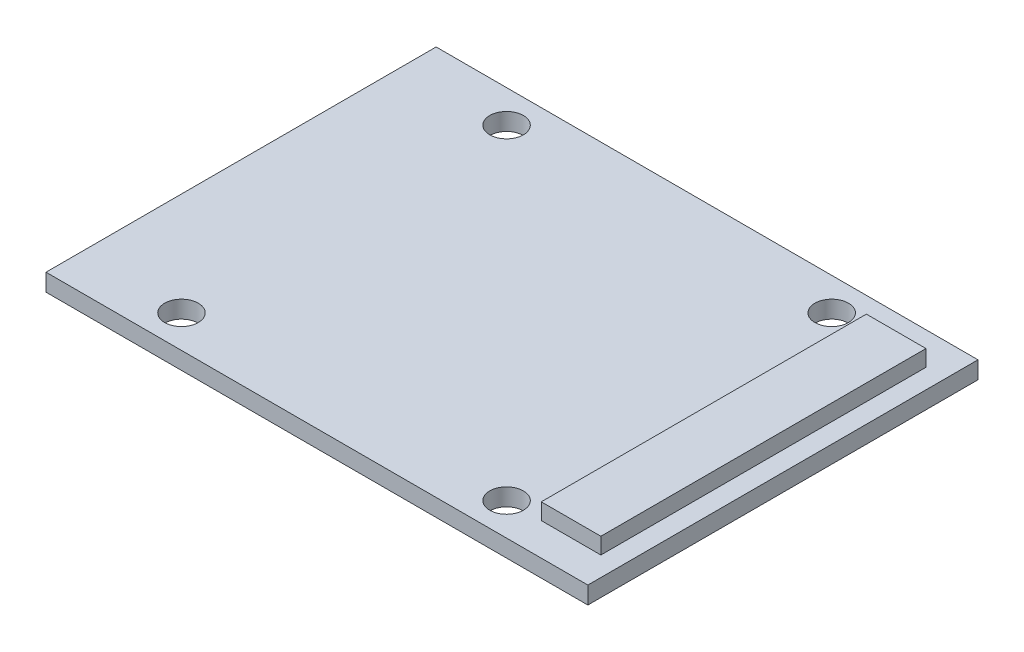
from build123d import *

# Parameters (mm, degrees)
SKETCH1_W           = 50
SKETCH1_H           = 36
SKETCH1_R           = 1.55
BOSS_EXTRUDE1_DEPTH = 1.6
SKETCH2_W           = 5.5
SKETCH2_H           = 30
BOSS_EXTRUDE2_DEPTH = 1.5


with BuildPart() as part:
    # Sketch1 → Boss-Extrude1 (new body)
    with BuildSketch(Plane(origin=(0, 0, 0), x_dir=(1, 0, 0), z_dir=(0, 1, 0))):
        Rectangle(SKETCH1_W, SKETCH1_H)
        with Locations(Location((-15.5, 15, 0), (0, 0, 270))):
            Circle(SKETCH1_R, mode=Mode.SUBTRACT)
        with Locations(Location((-15.5, -15, 0), (0, 0, 90))):
            Circle(SKETCH1_R, mode=Mode.SUBTRACT)
        with Locations(Location((14.5, 15, 0), (0, 0, 270))):
            Circle(SKETCH1_R, mode=Mode.SUBTRACT)
        with Locations(Location((14.5, -15, 0), (0, 0, 90))):
            Circle(SKETCH1_R, mode=Mode.SUBTRACT)
    extrude(amount=BOSS_EXTRUDE1_DEPTH)

    # Sketch2 → Boss-Extrude2 (add)
    with BuildSketch(Plane(origin=(0, 1.6, 0), x_dir=(1, 0, 0), z_dir=(0, 1, 0))):
        with Locations((20.45, 0)):
            Rectangle(SKETCH2_W, SKETCH2_H)
    extrude(amount=BOSS_EXTRUDE2_DEPTH)


solid = part.part
